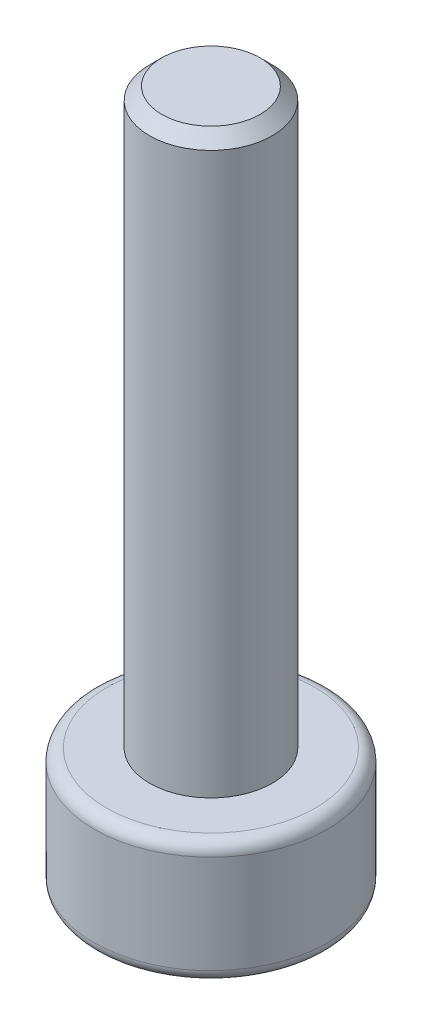
from build123d import *

# Parameters (mm, degrees)
SKETCH_1_R          = 2.85
EXTRUDE_1_DEPTH     = 3
SKETCH_2_R          = 1.5
EXTRUDE_2_DEPTH     = 14
SKETCH_3_R          = 1.29
CUT_EXTRUDE_1_DEPTH = 1.3
FILLET_1_R          = 0.3
CHAMFER_1_SIZE      = 0.3
CHAMFER_2_SIZE      = 0.15


with BuildPart() as part:
    # 草图1 → 凸台-拉伸1 (new body)
    with BuildSketch(Plane(origin=(0, 0, 0), x_dir=(1, 0, 0), z_dir=(0, 1, 0))):
        with Locations(Location((0, 0, 0), (0, 0, 270))):
            Circle(SKETCH_1_R)
    extrude(amount=EXTRUDE_1_DEPTH)

    # 草图2 → 凸台-拉伸2 (add)
    with BuildSketch(Plane(origin=(0, 3, 0), x_dir=(1, 0, 0), z_dir=(0, 1, 0))):
        with Locations(Location((0, 0, 0), (0, 0, 270))):
            Circle(SKETCH_2_R)
    extrude(amount=EXTRUDE_2_DEPTH)

    # 草图3 → 切除-拉伸1 (cut)
    with BuildSketch(Plane.XZ):
        with Locations(Location((0, 0, 0), (0, 0, 270))):
            Circle(SKETCH_3_R)
    extrude(amount=-CUT_EXTRUDE_1_DEPTH, mode=Mode.SUBTRACT)

    # 圆角1
    fillet_1_edges = [part.edges().sort_by_distance(p)[0] for p in [
        (0, 0, -2.85),
        (0, 3, -2.85),
    ]]
    fillet(fillet_1_edges, radius=FILLET_1_R)

    # 倒角1
    chamfer_1_edges = [part.edges().sort_by_distance(p)[0] for p in [
        (0, 17, -1.5),
    ]]
    chamfer(chamfer_1_edges, length=CHAMFER_1_SIZE)

    # 倒角2
    chamfer_2_edges = [part.edges().sort_by_distance(p)[0] for p in [
        (0, 0, 1.29),
    ]]
    chamfer(chamfer_2_edges, length=CHAMFER_2_SIZE)


solid = part.part
